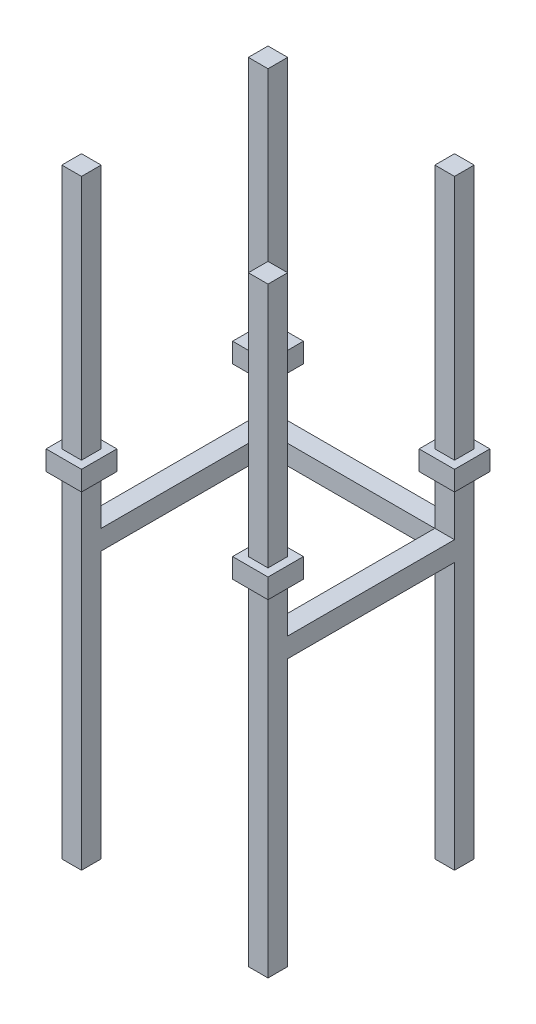
from build123d import *

# Parameters (mm, degrees)
CROQUIS1_W                = 50
CROQUIS1_H                = 50
SALIENTE_EXTRUIR1_DEPTH   = 625
SALIENTE_EXTRUIR1_2_DEPTH = 625
SALIENTE_EXTRUIR1_3_DEPTH = 625
SALIENTE_EXTRUIR1_4_DEPTH = 625
CROQUIS2_W                = 90
CROQUIS2_H                = 90
SALIENTE_EXTRUIR2_DEPTH   = 50
CROQUIS4_W                = 50
CROQUIS4_H                = 50
SALIENTE_EXTRUIR3_DEPTH   = 853
SALIENTE_EXTRUIR4_DEPTH   = 50


with BuildPart() as part:
    # Croquis1 → Saliente-Extruir1 (new body)
    with BuildSketch(Plane(origin=(0, 0, 0), x_dir=(1, 0, 0), z_dir=(0, 1, 0))):
        with Locations((-237.132034356, 237.132034356)):
            Rectangle(CROQUIS1_W, CROQUIS1_H)
    extrude(amount=-SALIENTE_EXTRUIR1_DEPTH)



with BuildPart() as body_2:
    # Croquis1 → Saliente-Extruir1 2 (new body)
    with BuildSketch(Plane(origin=(0, 0, 0), x_dir=(1, 0, 0), z_dir=(0, 1, 0))):
        with Locations((237.132034356, 237.132034356)):
            Rectangle(CROQUIS1_W, CROQUIS1_H)
    extrude(amount=-SALIENTE_EXTRUIR1_2_DEPTH)


with BuildPart() as body_3:
    # Croquis1 → Saliente-Extruir1 3 (new body)
    with BuildSketch(Plane(origin=(0, 0, 0), x_dir=(1, 0, 0), z_dir=(0, 1, 0))):
        with Locations((-237.132034356, -237.132034356)):
            Rectangle(CROQUIS1_W, CROQUIS1_H)
    extrude(amount=-SALIENTE_EXTRUIR1_3_DEPTH)


with BuildPart() as body_4:
    # Croquis1 → Saliente-Extruir1 4 (new body)
    with BuildSketch(Plane(origin=(0, 0, 0), x_dir=(1, 0, 0), z_dir=(0, 1, 0))):
        with Locations((237.132034356, -237.132034356)):
            Rectangle(CROQUIS1_W, CROQUIS1_H)
    extrude(amount=-SALIENTE_EXTRUIR1_4_DEPTH)


with BuildPart() as part_1:
    add(part.part)

    add(body_2.part)  # Saliente-Extruir2 merges body 2

    add(body_3.part)  # Saliente-Extruir2 merges body 3

    add(body_4.part)  # Saliente-Extruir2 merges body 4
    # Croquis2 → Saliente-Extruir2 (add)
    with BuildSketch(Plane.XZ.offset(625)):
        with Locations((-237.132034356, 237.132034356)):
            Rectangle(CROQUIS2_W, CROQUIS2_H)
        with Locations((237.132034356, 237.132034356)):
            Rectangle(CROQUIS2_W, CROQUIS2_H)
        with Locations((237.132034356, -237.132034356)):
            Rectangle(CROQUIS2_W, CROQUIS2_H)
        with Locations((-237.132034356, -237.132034356)):
            Rectangle(CROQUIS2_W, CROQUIS2_H)
    extrude(amount=SALIENTE_EXTRUIR2_DEPTH)

    # Croquis4 → Saliente-Extruir3 (add)
    with BuildSketch(Plane.XZ.offset(675)):
        with Locations((-237.132034356, 237.132034356)):
            Rectangle(CROQUIS4_W, CROQUIS4_H)
        with Locations((-237.132034356, -237.132034356)):
            Rectangle(CROQUIS4_W, CROQUIS4_H)
        with Locations((237.132034356, 237.132034356)):
            Rectangle(CROQUIS4_W, CROQUIS4_H)
        with Locations((237.132034356, -237.132034356)):
            Rectangle(CROQUIS4_W, CROQUIS4_H)
    extrude(amount=SALIENTE_EXTRUIR3_DEPTH)

    # Croquis6 → Saliente-Extruir4 (add)
    with BuildSketch(Plane(origin=(0, -800, 0), x_dir=(1, 0, 0), z_dir=(0, 1, 0))):
        Polygon((-262.132034356, 262.132034356), (262.132034356, 262.132034356), (262.132034356, -262.132034356), (212.132034356, -262.132034356), (212.132034356, -212.132034356), (212.132034356, 212.132034356), (-212.132034356, 212.132034356), (-212.132034356, -212.132034356), (-212.132034356, -262.132034356), (-262.132034356, -262.132034356), align=None)
    extrude(amount=-SALIENTE_EXTRUIR4_DEPTH)


solid = part_1.part
